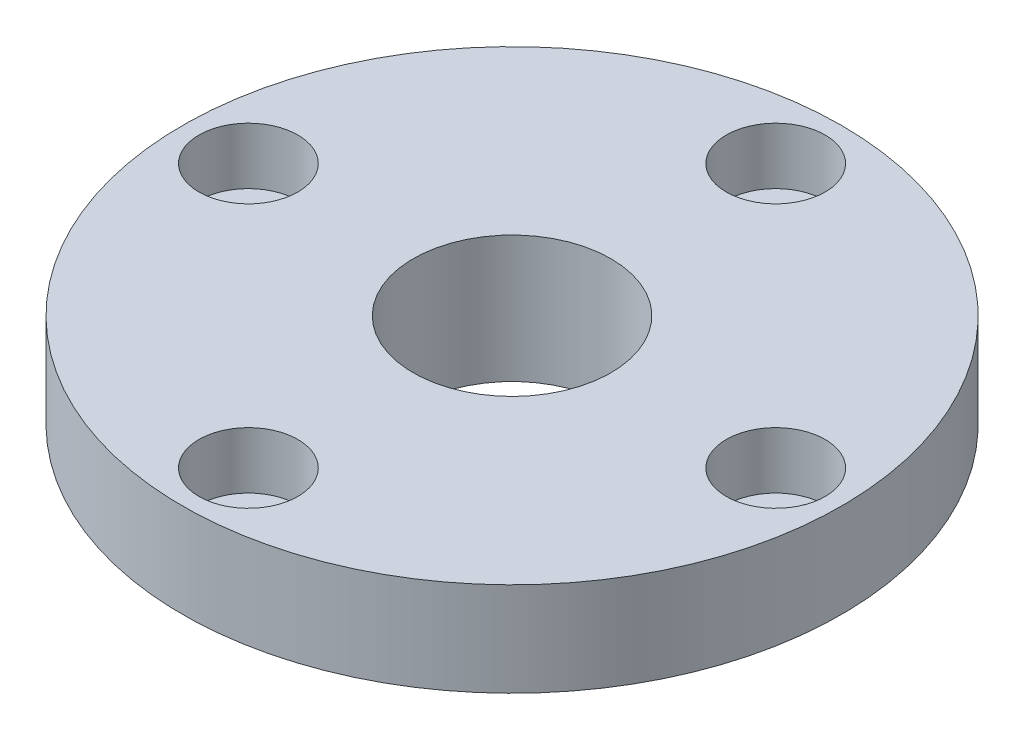
from build123d import *

# Parameters (mm, degrees)
POG_BIENIE_WALCOWE_POD_M8_WKR_T_Z_BEM_W_D           = 9
POG_BIENIE_WALCOWE_POD_M8_WKR_T_Z_BEM_W_DEPTH       = 42
POG_BIENIE_WALCOWE_POD_M8_WKR_T_Z_BEM_W_CBORE_D     = 15
POG_BIENIE_WALCOWE_POD_M8_WKR_T_Z_BEM_W_CBORE_DEPTH = 8.6
POG_BIENIE_WALCOWE_POD_M8_WKR_T_Z_BEM_W_TIP         = 2.703872786


with BuildPart() as part:
    # Szkic1 → Obrót1 (revolve)
    with BuildSketch(Plane.XY, mode=Mode.PRIVATE) as obr_t1_sk:
        Polygon((-15, 20.532632774), (-50, 20.532632774), (-50, 6.282632774), (-32.5, 6.282632774), (-32.5, 1.282632774), (-15, 1.282632774), align=None)
    revolve(obr_t1_sk.sketch.rotate(Axis((0, 0, 0), (0, 1, 0)), 270), axis=Axis((0, 0, 0), (0, 1, 0)))

    # Pogłębienie walcowe pod M8 Wkręt z łbem walcowym z gniazdem sześciokątnym1
    with Locations(Plane(origin=(-40, 20.532632774, 0), x_dir=(0, 0, 1), z_dir=(0, 1, 0))):
        with Locations((0, 0), (-40, 40), (0, 80), (40, 40)):
            CounterBoreHole(POG_BIENIE_WALCOWE_POD_M8_WKR_T_Z_BEM_W_D / 2, POG_BIENIE_WALCOWE_POD_M8_WKR_T_Z_BEM_W_CBORE_D / 2, POG_BIENIE_WALCOWE_POD_M8_WKR_T_Z_BEM_W_CBORE_DEPTH, depth=POG_BIENIE_WALCOWE_POD_M8_WKR_T_Z_BEM_W_DEPTH)
            with Locations((0, 0, -(POG_BIENIE_WALCOWE_POD_M8_WKR_T_Z_BEM_W_DEPTH + POG_BIENIE_WALCOWE_POD_M8_WKR_T_Z_BEM_W_TIP / 2))):  # 118° drill point
                Cone(0, POG_BIENIE_WALCOWE_POD_M8_WKR_T_Z_BEM_W_D / 2, POG_BIENIE_WALCOWE_POD_M8_WKR_T_Z_BEM_W_TIP, mode=Mode.SUBTRACT)


solid = part.part
